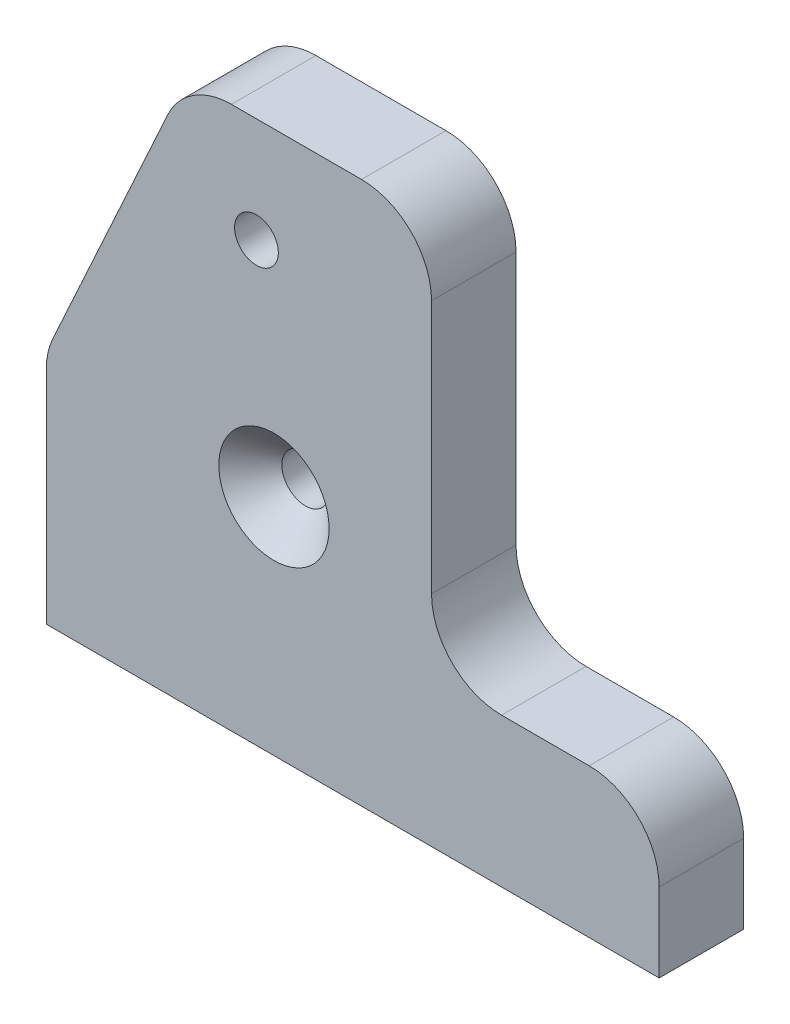
from build123d import *

# Parameters (mm, degrees)
BOSS_EXTRUDE1_DEPTH                             = 4.826
M3X0_5_TAPPED_HOLE2_D                           = 2.5
M3X0_5_TAPPED_HOLE3_D                           = 2.5
M3X0_5_TAPPED_HOLE3_DEPTH                       = 5
M3X0_5_TAPPED_HOLE3_TIP                         = 0.751075774
FILLET2_R                                       = 4
SKETCH19_R                                      = 1.25
CUT_EXTRUDE1_DEPTH                              = 10
CSK_FOR_M3_FLAT_HEAD_MACHINE_SCREW1_D           = 2.7
CSK_FOR_M3_FLAT_HEAD_MACHINE_SCREW1_CSINK_D     = 6.3
CSK_FOR_M3_FLAT_HEAD_MACHINE_SCREW1_CSINK_ANGLE = 90


with BuildPart() as part:
    # Sketch1 → Boss-Extrude1 (new body)
    with BuildSketch(Plane.XY):
        Polygon((0, 0), (0, 13.5), (8, 31), (22, 31), (22, 8.5), (35, 8.5), (35, 0), align=None)
    extrude(amount=BOSS_EXTRUDE1_DEPTH)

    # M3x0.5 Tapped Hole2 (through all)
    with Locations(Plane.XY.offset(4.826)):
        with Locations((12, 25)):
            Hole(M3X0_5_TAPPED_HOLE2_D / 2)

    # M3x0.5 Tapped Hole3
    with Locations(Plane(origin=(0, 0, 0), x_dir=(-1, 0, 0), z_dir=(0, -1, 0))):
        with Locations((-16.73, -2.413), (-28.73, -2.413)):
            Hole(M3X0_5_TAPPED_HOLE3_D / 2, depth=M3X0_5_TAPPED_HOLE3_DEPTH)
            with Locations((0, 0, -(M3X0_5_TAPPED_HOLE3_DEPTH + M3X0_5_TAPPED_HOLE3_TIP / 2))):  # 118° drill point
                Cone(0, M3X0_5_TAPPED_HOLE3_D / 2, M3X0_5_TAPPED_HOLE3_TIP, mode=Mode.SUBTRACT)

    # Fillet2
    fillet2_edges = [part.edges().sort_by_distance(p)[0] for p in [
        (22, 31, 2.413),
        (22, 8.5, 2.413),
        (35, 8.5, 2.413),
        (0, 13.5, 2.413),
        (8, 31, 2.413),
    ]]
    fillet(fillet2_edges, radius=FILLET2_R)

    # Sketch19 → Cut-Extrude1 (cut)
    with BuildSketch(Plane.XY.offset(4.826)):
        with Locations((13, 12.8)):
            Circle(SKETCH19_R)
    extrude(amount=-CUT_EXTRUDE1_DEPTH, mode=Mode.SUBTRACT)

    # CSK for M3 Flat Head Machine Screw1 (through all)
    with Locations(Plane.XY.offset(4.826)):
        with Locations((13, 12.8)):
            CounterSinkHole(CSK_FOR_M3_FLAT_HEAD_MACHINE_SCREW1_D / 2, CSK_FOR_M3_FLAT_HEAD_MACHINE_SCREW1_CSINK_D / 2, counter_sink_angle=CSK_FOR_M3_FLAT_HEAD_MACHINE_SCREW1_CSINK_ANGLE)


solid = part.part
